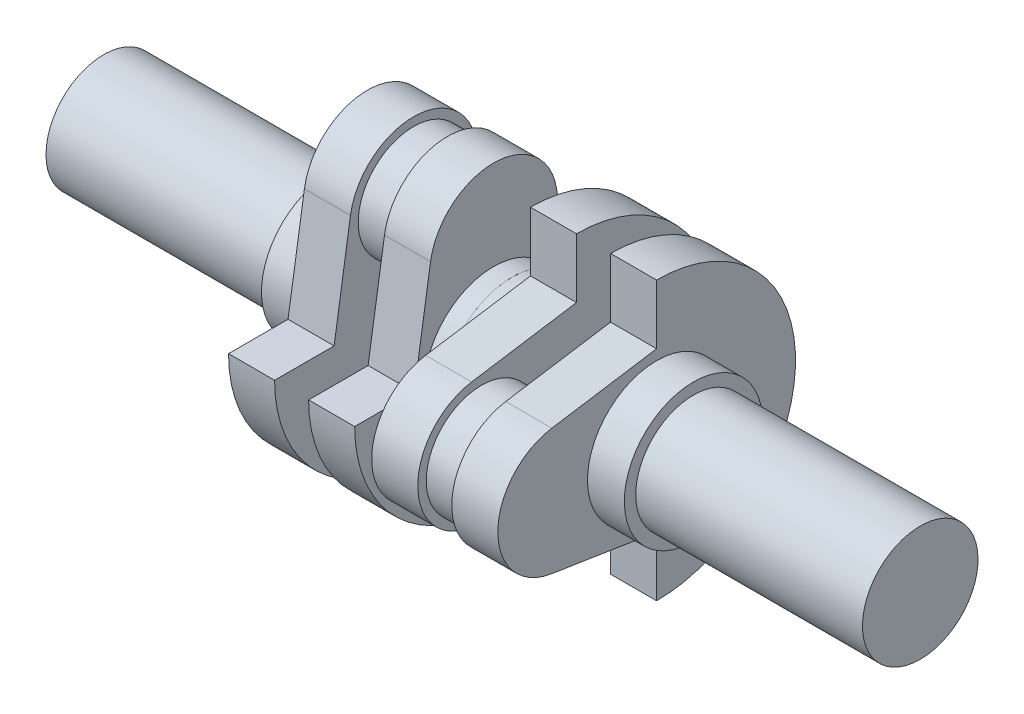
from build123d import *

# Parameters (mm, degrees)
SKETCH1_R             = 38.6953125
BOSS_EXTRUDE1_DEPTH   = 20.6375
SKETCH2_R             = 90.4875
BOSS_EXTRUDE2_DEPTH   = 25.796875
SKETCH3_R             = 30.95625
BOSS_EXTRUDE3_DEPTH   = 9.525
SKETCH5_R             = 90.4875
CUT_EXTRUDE1_DEPTH    = 137.132753201
SKETCH8_R             = 32.3453125
BOSS_EXTRUDE5_DEPTH   = 127
CUT_EXTRUDE2_DEPTH    = 249.195103211
SKETCH10_R            = 38.6953125
BOSS_EXTRUDE6_DEPTH   = 10.31875
BODY_MOVE_COPY3_ANGLE = 90


with BuildPart() as part:
    # Sketch1 → Boss-Extrude1 (new body)
    with BuildSketch(Plane(origin=(0, 0, 0), x_dir=(0, 0, -1), z_dir=(1, 0, 0))):
        Circle(SKETCH1_R)
    extrude(amount=BOSS_EXTRUDE1_DEPTH)

    # Sketch2 → Boss-Extrude2 (add)
    with BuildSketch(Plane(origin=(20.6375, 0, 0), x_dir=(0, 0, -1), z_dir=(1, 0, 0))):
        Circle(SKETCH2_R)
    extrude(amount=BOSS_EXTRUDE2_DEPTH)

    # Sketch3 → Boss-Extrude3 (add)
    with BuildSketch(Plane(origin=(46.434375, 0, 0), x_dir=(0, 0, -1), z_dir=(1, 0, 0))):
        with Locations((0, 53.18125)):
            Circle(SKETCH3_R)
    extrude(amount=BOSS_EXTRUDE3_DEPTH)

    # Sketch5 → Cut-Extrude1 (cut, through all)
    with BuildSketch(Plane(origin=(46.434375, 0, 0), x_dir=(0, 0, -1), z_dir=(1, 0, 0))):
        Circle(SKETCH5_R)
        with BuildLine():
            ThreePointArc((77.7875, 0), (0, -77.7875), (-77.7875, 0))
            Line((-77.7875, 0), (-44.45, 0))
            Line((-44.45, 0), (-35.291628224, 58.688525083))
            ThreePointArc((-35.291628224, 58.688525083), (0, 88.9), (35.291628224, 58.688525083))
            Line((35.291628224, 58.688525083), (44.45, 0))
            Line((44.45, 0), (77.7875, 0))
        make_face(mode=Mode.SUBTRACT)
    extrude(amount=-CUT_EXTRUDE1_DEPTH, mode=Mode.SUBTRACT)

    # Mirror1: part across plane


with BuildPart() as part_1:
    add(part.part)
    add(part.part.mirror(Plane(origin=(55.959375, 53.18125, 0), x_dir=(0, 0, 1), z_dir=(1, 0, 0))))

    # Sketch8 → Boss-Extrude5 (add)
    with BuildSketch(Plane.ZY):
        Circle(SKETCH8_R)
    extrude(amount=BOSS_EXTRUDE5_DEPTH)

    # Sketch9 → Cut-Extrude2 (cut, through all)
    with BuildSketch(Plane(origin=(91.28125, 0, 0), x_dir=(0, 0, -1), z_dir=(1, 0, 0))):
        with BuildLine():
            Line((-35.291628224, 58.688525083), (-44.45, 0))
            Line((-44.45, 0), (-77.7875, 0))
            ThreePointArc((-77.7875, 0), (0, -77.7875), (77.7875, 0))
            Line((77.7875, 0), (44.45, 0))
            Line((44.45, 0), (35.291628224, 58.688525083))
            ThreePointArc((35.291628224, 58.688525083), (0, 88.9), (-35.291628224, 58.688525083))
        make_face()
    extrude(amount=CUT_EXTRUDE2_DEPTH, mode=Mode.SUBTRACT)

    # Sketch10 → Boss-Extrude6 (add)
    with BuildSketch(Plane(origin=(91.28125, 0, 0), x_dir=(0, 0, -1), z_dir=(1, 0, 0))):
        Circle(SKETCH10_R)
    extrude(amount=BOSS_EXTRUDE6_DEPTH)


with BuildPart() as body_2:
    # Mirror4: mirrored copy
    add(part_1.part.mirror(Plane(origin=(101.6, 0, 0), x_dir=(0, 0, 1), z_dir=(1, 0, 0))))


with BuildPart() as body_2_1:
    # Body-Move/Copy3: moved
    add(body_2.part.rotate(Axis((0, 0, 0), (1, 0, 0)), BODY_MOVE_COPY3_ANGLE))


solid = Compound([part_1.part, body_2_1.part])
